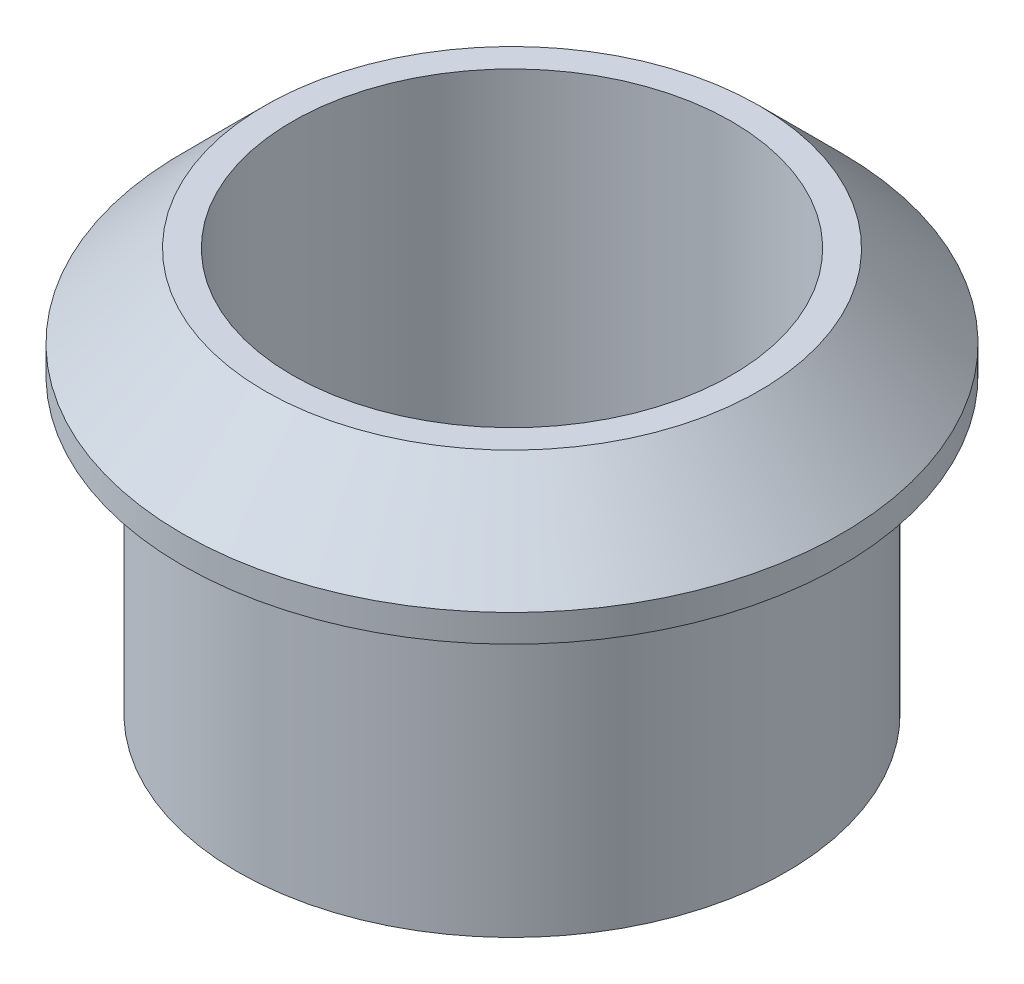
from build123d import *


with BuildPart() as part:
    # Sketch1 → Revolve1 (revolve)
    with BuildSketch(Plane.XY):
        Polygon((6, 0), (6, 11), (6.75, 11), (9, 8.75), (9, 8), (7.495, 8), (7.495, 0), align=None)
    revolve(axis=Axis((0, 0, 0), (0, 1, 0)))


solid = part.part
